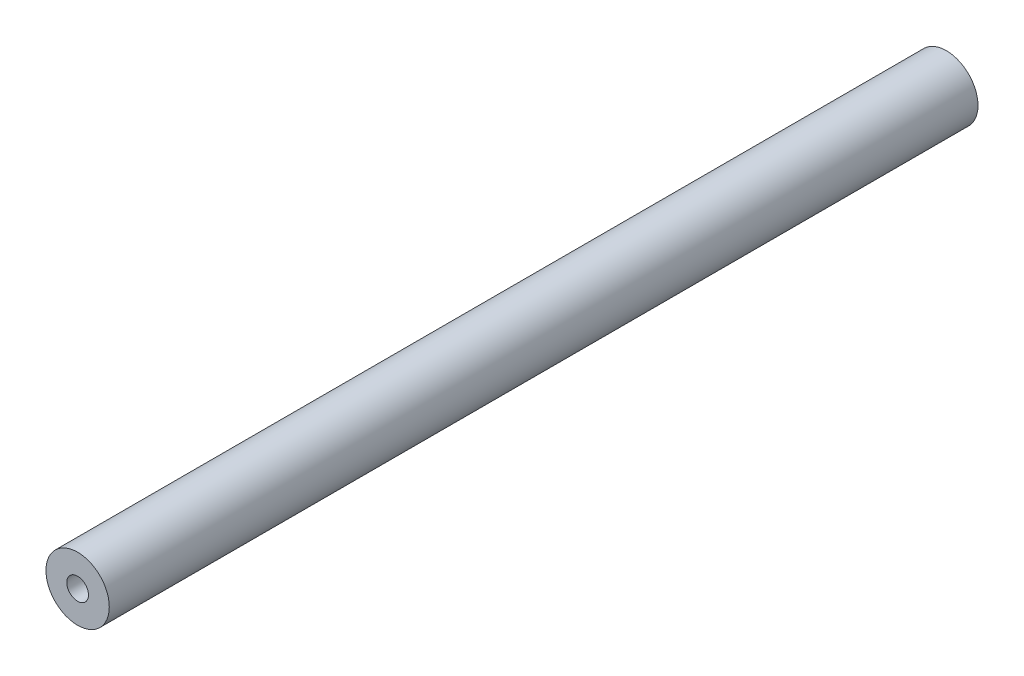
from build123d import *

# Parameters (mm, degrees)
SKETCH1_R           = 8.75
BOSS_EXTRUDE1_DEPTH = 240
SKETCH2_R           = 3
CUT_EXTRUDE2_DEPTH  = 276


with BuildPart() as part:
    # Sketch1 → Boss-Extrude1 (new body)
    with BuildSketch(Plane.XY):
        Circle(SKETCH1_R)
    extrude(amount=BOSS_EXTRUDE1_DEPTH)

    # Sketch2 → Cut-Extrude2 (cut)
    with BuildSketch(Plane.XY):
        Circle(SKETCH2_R)
    extrude(amount=CUT_EXTRUDE2_DEPTH, mode=Mode.SUBTRACT)


solid = part.part
